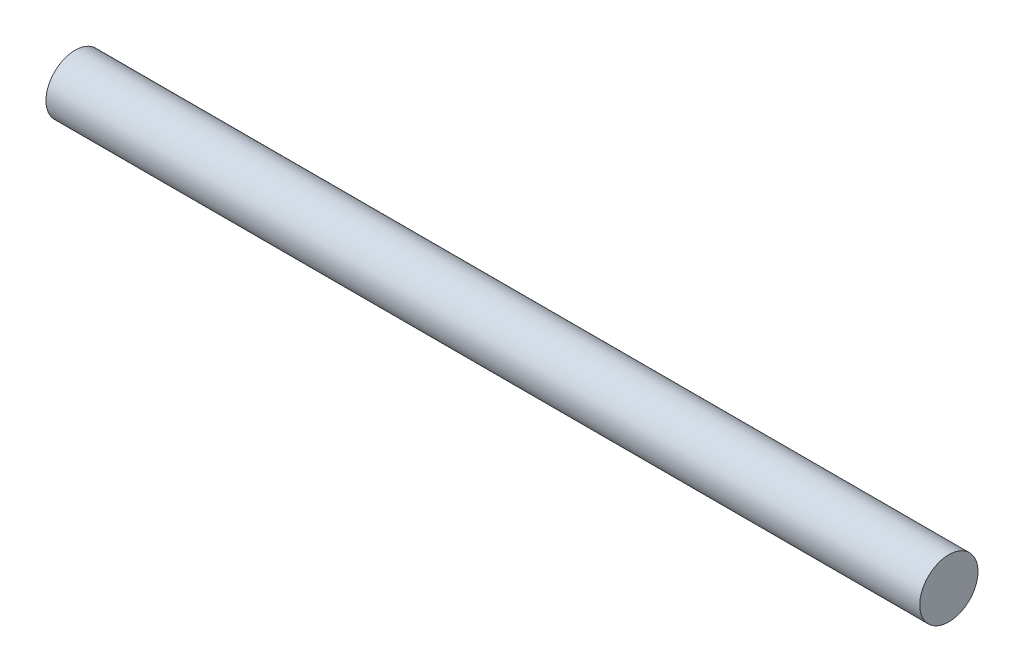
from build123d import *

# Parameters (mm, degrees)
BOSS_EXTRUDE1_DEPTH      = 75
BOSS_EXTRUDE1_DEPTH_BACK = 75
SKETCH1_R                = 5


with BuildPart() as part:
    # Sketch1 → Boss-Extrude1 (new, two sides: drawn at the far end of the back side and taken through both)
    with BuildSketch(Plane(origin=(0, 0, 0), x_dir=(0, 0, -1), z_dir=(1, 0, 0)).offset(-BOSS_EXTRUDE1_DEPTH_BACK)):
        Circle(SKETCH1_R)
    extrude(amount=BOSS_EXTRUDE1_DEPTH + BOSS_EXTRUDE1_DEPTH_BACK)


solid = part.part
